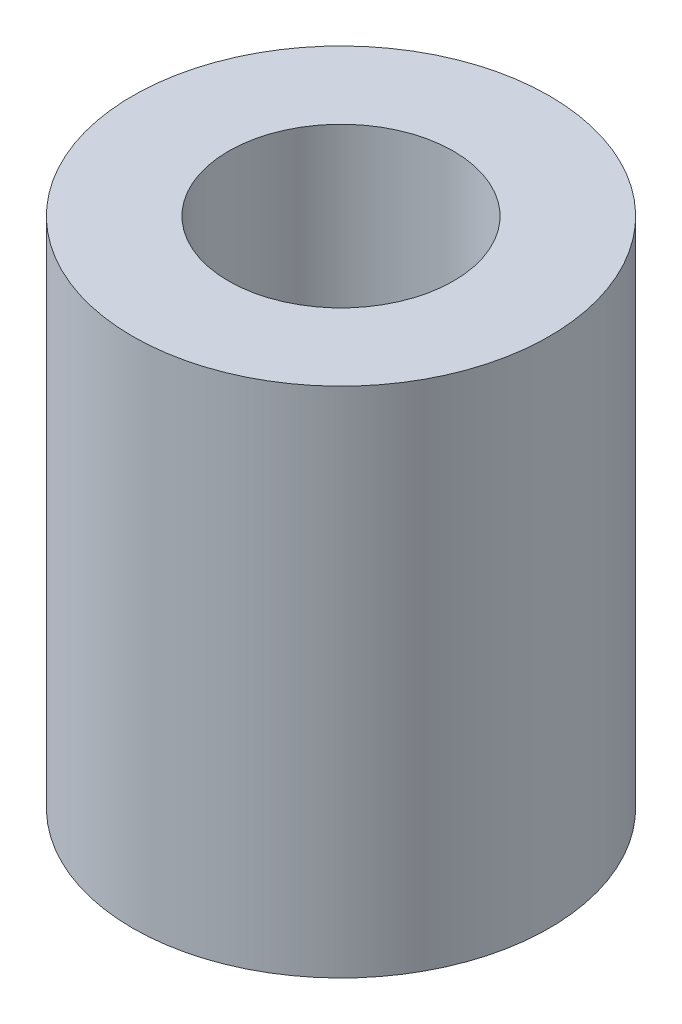
from build123d import *

# Parameters (mm, degrees)
SKETCH1_R           = 6.35
SKETCH1_R_2         = 3.429
BOSS_EXTRUDE1_DEPTH = 15.621


with BuildPart() as part:
    # Sketch1 → Boss-Extrude1 (new body)
    with BuildSketch(Plane(origin=(0, 0, 0), x_dir=(1, 0, 0), z_dir=(0, 1, 0))):
        with Locations(Location((0, 0, 0), (0, 0, 90))):
            Circle(SKETCH1_R)
        with Locations(Location((0, 0, 0), (0, 0, 90))):
            Circle(SKETCH1_R_2, mode=Mode.SUBTRACT)
    extrude(amount=BOSS_EXTRUDE1_DEPTH)


solid = part.part
